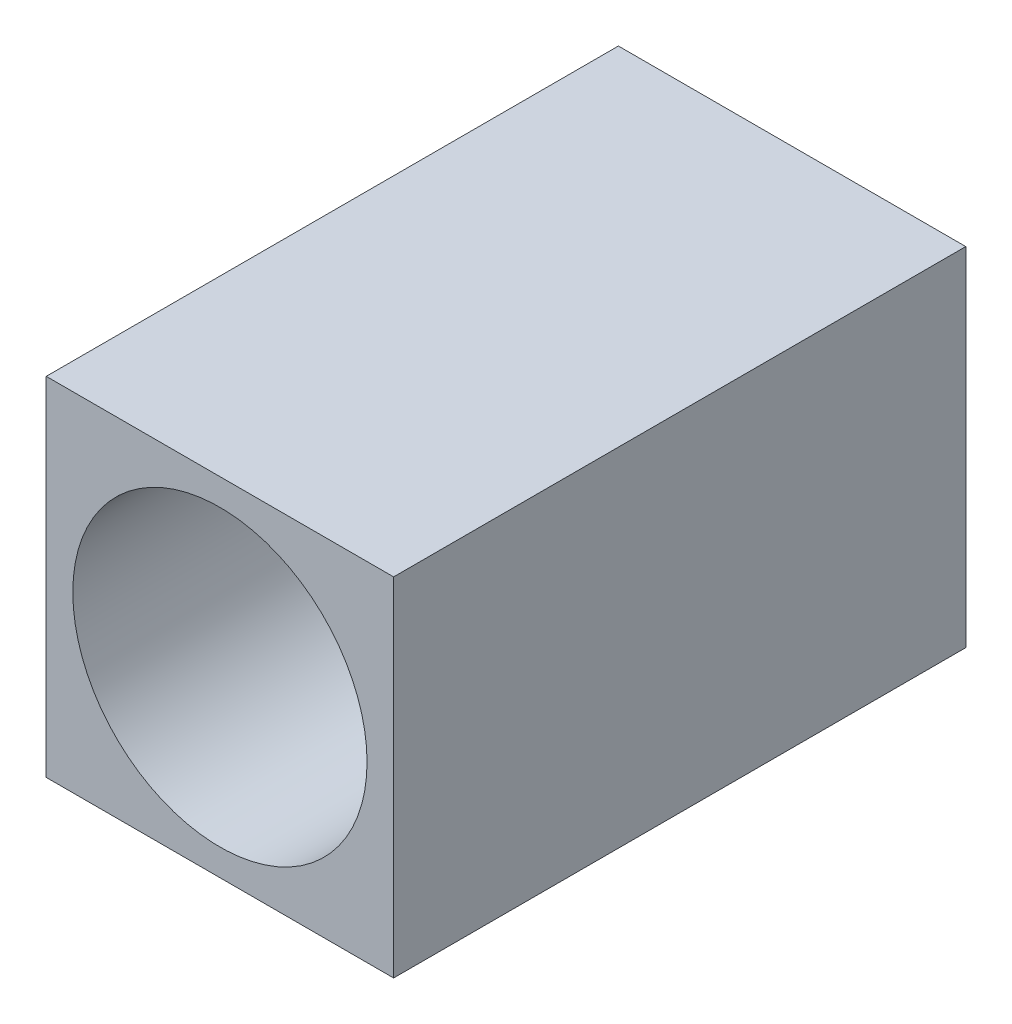
from build123d import *

# Parameters (mm, degrees)
SKETCH_1_W      = 85
SKETCH_1_H      = 85
SKETCH_1_R      = 36
EXTRUDE_1_DEPTH = 140


with BuildPart() as part:
    # ｽｹｯﾁ1 → ﾎﾞｽ - 押し出し1 (new body)
    with BuildSketch(Plane.XY):
        Rectangle(SKETCH_1_W, SKETCH_1_H)
        Circle(SKETCH_1_R, mode=Mode.SUBTRACT)
    extrude(amount=EXTRUDE_1_DEPTH)


solid = part.part
